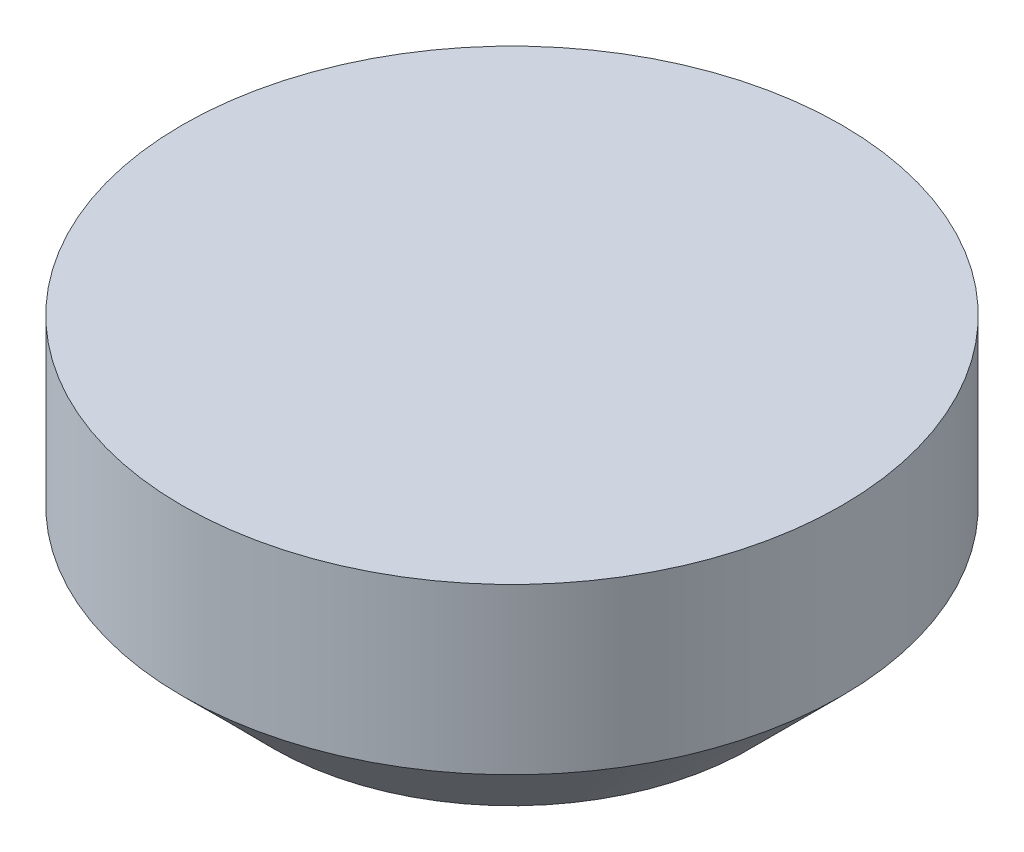
from build123d import *


with BuildPart() as part:
    # Эскиз1 → Повернуть1 (revolve)
    with BuildSketch(Plane.XY, mode=Mode.PRIVATE) as revolve_1_sk:
        Polygon((0, 0), (-9, 0), (-9, -4.5), (-6.5, -7), (-6, -7), (-6, -2), (0, -2), align=None)
    revolve(revolve_1_sk.sketch.rotate(Axis((0, -2, 0), (0, 1, 0)), 270), axis=Axis((0, -2, 0), (0, 1, 0)))


solid = part.part
